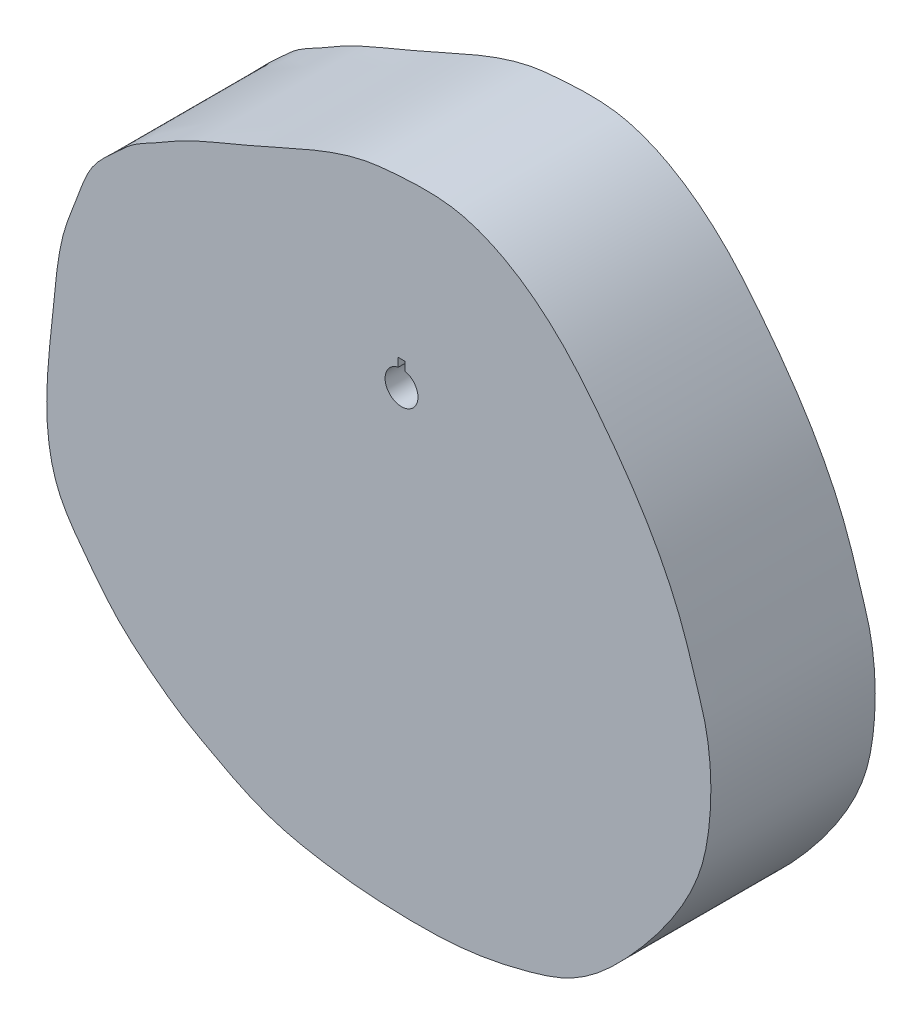
from build123d import *

# Parameters (mm, degrees)
EXTRUDE_6_DEPTH = 10


with BuildPart() as part:
    # Model → 凸台-拉伸6 (new body)
    # profile 1 of 5: a face of its own
    with BuildSketch(Plane.XY):
        with BuildLine():
            add(Edge.make_bspline(
                [(50.327348879, 72.110385395), (50.551196695, 72.209853079), (50.774771336, 72.310002208), (50.99828595, 72.410227179)],
                knots=[0.994126967, 0.994126967, 0.994126967, 0.994126967, 1, 1, 1, 1], degree=3))
            add(Edge.make_bspline(
                [(50.99828595, 72.410227179), (52.00855204, 72.863235095), (53.769573771, 73.656549063), (56.197949252, 74.4105602), (58.293529438, 74.604423777), (60.066206981, 74.693082407), (62.060842215, 74.541351708), (64.126269828, 73.834318473), (66.349208665, 72.490436035), (68.475957607, 70.616090239), (70.759213858, 67.843640334), (73.360295732, 64.257523025), (75.459483797, 60.178954808), (76.357096747, 57.126402616), (77.002925276, 55.061063067), (77.356950559, 53.017652635), (77.334939647, 50.285351358), (76.822227847, 47.030157279), (75.091971455, 43.71732089), (72.654728342, 40.694302093), (70.424080177, 38.502806605), (68.316461529, 37.217387766), (66.238861486, 36.572685886), (63.962576858, 36.03676818), (61.367476886, 35.701877622), (58.726180761, 35.685427345), (56.067919129, 35.81112316), (53.544167975, 36.137482718), (51.11894155, 36.594554509), (48.813349179, 37.505045086), (46.975869576, 38.505075731), (45.233846145, 39.4393401), (43.277399852, 40.841836991), (41.139900825, 42.596061425), (39.299034251, 45.033791125), (37.29945877, 47.651580718), (36.766606498, 51.39009884), (37.075288646, 54.929946918), (37.429133575, 58.326632929), (37.740859687, 61.17608892), (38.800732341, 63.667905164), (39.499386787, 65.796117339), (40.975310964, 67.073149421), (42.151744933, 68.217615029), (43.509812794, 68.879131649), (45.224172764, 69.943141406), (47.382369971, 70.856185044), (49.215606742, 71.619112396), (50.143195558, 72.028556121), (50.327348879, 72.110385395)],
                knots=[0, 0, 0, 0, 0.026545586, 0.046328554, 0.060553475, 0.076867854, 0.088874367, 0.108295375, 0.12851837, 0.150854463, 0.17589792, 0.214482615, 0.256992751, 0.28498903, 0.290659406, 0.308875672, 0.33440091, 0.355920428, 0.387259923, 0.422470783, 0.449004595, 0.461678734, 0.481273675, 0.500786423, 0.517774705, 0.543868946, 0.564008175, 0.581535671, 0.604880577, 0.622945933, 0.640688461, 0.655045158, 0.670269379, 0.698381104, 0.720780204, 0.74353058, 0.776229956, 0.807771363, 0.829063148, 0.858259645, 0.875614659, 0.894090137, 0.910613695, 0.921398486, 0.933328696, 0.946471969, 0.969814483, 0.989295387, 0.994126967, 0.994126967, 0.994126967, 0.994126967], degree=3))
        make_face()
        with BuildLine():
            add(Edge.make_bspline(
                [(56.251302083, 62.345052083), (56.23073444, 62.335232097), (56.189042839, 62.315326512), (56.123393886, 62.290150746), (56.05419121, 62.26964269), (55.981823108, 62.252026497), (55.905982385, 62.238733264), (55.826854707, 62.229439715), (55.74446656, 62.22290953), (55.688381448, 62.222454659), (55.659722222, 62.222222222)],
                knots=[0, 0, 0, 0, 0.896967235, 1.818195668, 2.764091818, 3.736549999, 4.748721906, 5.792788735, 6.872125551, 8, 8, 8, 8], degree=3))
            add(Edge.make_bspline(
                [(55.659722222, 62.222222222), (55.638442195, 62.222367719), (55.59698153, 62.222651195), (55.536469715, 62.227878751), (55.478977925, 62.234773559), (55.424709985, 62.245908078), (55.373305092, 62.259176755), (55.324853268, 62.275561445), (55.279842249, 62.295616296), (55.237667005, 62.318272192), (55.198923242, 62.343959742), (55.162368041, 62.371469813), (55.128631634, 62.401576043), (55.096794127, 62.433441538), (55.068149136, 62.468148385), (55.041549829, 62.504539679), (55.017617743, 62.543292122), (54.989808486, 62.597197653), (54.960903133, 62.665712348), (54.935381149, 62.748379195), (54.919991615, 62.83030279), (54.91776574, 62.884632077), (54.916666667, 62.911458333)],
                knots=[0, 0, 0, 0, 1.118512267, 2.179238879, 3.191701636, 4.16145139, 5.089578407, 5.982104873, 6.847203939, 7.677764153, 8.49642878, 9.289127057, 10.081350653, 10.872111906, 11.655224959, 12.444960961, 13.240865015, 14.047279251, 15.632548039, 17.143788409, 18.589683966, 20, 20, 20, 20], degree=3))
            add(Edge.make_bspline(
                [(54.916666667, 62.911458333), (54.917218853, 62.938252753), (54.91832968, 62.992154816), (54.928441185, 63.072938433), (54.943898269, 63.153941159), (54.966289236, 63.235000662), (54.995060503, 63.316129475), (55.029903523, 63.397434535), (55.070952827, 63.478870065), (55.117803091, 63.559905085), (55.170587058, 63.63868082), (55.227444147, 63.714636543), (55.289116095, 63.786226751), (55.355354718, 63.853642573), (55.425672913, 63.917138353), (55.500666881, 63.976385521), (55.580147565, 64.031298989), (55.66293854, 64.082316864), (55.747937289, 64.127948771), (55.833310384, 64.168117655), (55.918722365, 64.201388326), (56.003304551, 64.229622102), (56.087975954, 64.250722619), (56.1721163, 64.26662008), (56.256297182, 64.275980298), (56.312333067, 64.277179663), (56.340277778, 64.277777778)],
                knots=[0, 0, 0, 0, 0.891727813, 1.793879796, 2.706413147, 3.635387819, 4.590565755, 5.57025294, 6.578371844, 7.625104803, 8.684483968, 9.733563766, 10.782112664, 11.827781172, 12.878220176, 13.934386086, 15.007311527, 16.092813136, 17.17034535, 18.21761013, 19.231923723, 20.220475117, 21.184261265, 22.134654363, 23.069764973, 24, 24, 24, 24], degree=3))
            add(Edge.make_bspline(
                [(56.340277778, 64.277777778), (56.372619915, 64.276725409), (56.436884043, 64.274634342), (56.531664697, 64.256817783), (56.624086365, 64.229261262), (56.697710471, 64.196077917), (56.754510452, 64.165128911), (56.794619876, 64.139013049), (56.832841132, 64.111195541), (56.868153064, 64.080778646), (56.901579562, 64.048642256), (56.931821198, 64.013646266), (56.960203441, 63.976855272), (56.993651565, 63.925310347), (57.029409203, 63.859310286), (57.060477945, 63.777799639), (57.079754863, 63.695630181), (57.082147092, 63.640579431), (57.083333333, 63.61328125)],
                knots=[0, 0, 0, 0, 1.404869401, 2.791488554, 4.178207542, 5.588808834, 6.292523413, 6.988580247, 7.667841365, 8.345907703, 9.013035821, 9.681585379, 10.354557584, 11.031368594, 12.350988927, 13.608983188, 14.814359309, 16, 16, 16, 16], degree=3))
            add(Edge.make_bspline(
                [(57.083333333, 63.61328125), (57.082617984, 63.58271288), (57.081181669, 63.521336177), (57.068284074, 63.429323355), (57.048463407, 63.337283096), (57.020383853, 63.24512818), (56.984250518, 63.152987053), (56.939669822, 63.060904556), (56.88741343, 62.968741838), (56.827986546, 62.877774955), (56.763639322, 62.790078389), (56.696855748, 62.707263432), (56.627670862, 62.631082785), (56.556399752, 62.561235256), (56.483704681, 62.496977553), (56.408175731, 62.440266614), (56.331378621, 62.388803353), (56.277865121, 62.359565281), (56.251302083, 62.345052083)],
                knots=[0, 0, 0, 0, 0.926444821, 1.860162235, 2.811792735, 3.779037682, 4.77776186, 5.809794321, 6.878432778, 7.988097194, 9.102408143, 10.175287959, 11.212509676, 12.220669197, 13.199935719, 14.151869495, 15.082624735, 16, 16, 16, 16], degree=3))
        make_face(mode=Mode.SUBTRACT)
        with BuildLine():
            Line((58, 60.5), (57.031914894, 60.5))
            Line((57.031914894, 60.5), (58.060447136, 62.601783278))
            ThreePointArc((58.060447136, 62.601783278), (57.508037392, 63.626531356), (58.3, 64.479795897))
            Line((58.3, 64.479795897), (58.3, 65))
            Line((58.3, 65), (58.5, 65))
            Line((58.5, 65), (58.7, 65))
            Line((58.7, 65), (58.712882856, 64.47707773))
            ThreePointArc((58.712882856, 64.47707773), (59.278743493, 64.127342468), (59.5, 63.5))
            ThreePointArc((59.5, 63.5), (59.348396388, 62.970638528), (58.939552864, 62.601783278))
            Line((58.939552864, 62.601783278), (59.968085106, 60.5))
            Line((59.968085106, 60.5), (59.122532015, 60.5))
            Line((59.122532015, 60.5), (58, 60.5))
        make_face(mode=Mode.SUBTRACT)
        with BuildLine():
            add(Edge.make_bspline(
                [(64.256944444, 66.977213542), (64.256459199, 67.001833409), (64.255543183, 67.048309263), (64.247870138, 67.1140279), (64.236030423, 67.171929336), (64.217741005, 67.222641095), (64.193691643, 67.2678463), (64.163667833, 67.309545203), (64.126163165, 67.347591393), (64.097861664, 67.370291527), (64.083333333, 67.381944444)],
                knots=[0, 0, 0, 0, 1.283547308, 2.423000768, 3.446000759, 4.358955944, 5.223879375, 6.108680517, 7.029107533, 8, 8, 8, 8], degree=3))
            Line((64.083333333, 67.381944444), (64.116427951, 67.486111111))
            add(Edge.make_bspline(
                [(64.116427951, 67.486111111), (64.141829877, 67.481039942), (64.191382375, 67.47114742), (64.262487501, 67.450757318), (64.32878241, 67.427754545), (64.389956049, 67.400847254), (64.446732276, 67.371334573), (64.49810854, 67.337392997), (64.545440491, 67.30131211), (64.586723729, 67.260555846), (64.623847893, 67.217182075), (64.656141352, 67.170406051), (64.68271191, 67.119772923), (64.70524232, 67.066179527), (64.721652349, 67.008703533), (64.734485572, 66.948401057), (64.741263855, 66.88459297), (64.74244949, 66.841050933), (64.743055556, 66.818793403)],
                knots=[0, 0, 0, 0, 1.230694538, 2.400762403, 3.512648367, 4.563451363, 5.574697968, 6.549790304, 7.486862249, 8.398638349, 9.301129484, 10.197583272, 11.09354242, 12.014590101, 12.955635291, 13.93000754, 14.941874979, 16, 16, 16, 16], degree=3))
            add(Edge.make_bspline(
                [(64.743055556, 66.818793403), (64.742664828, 66.794542316), (64.74188779, 66.746314266), (64.734800948, 66.674279696), (64.725074283, 66.602756284), (64.709340798, 66.532088218), (64.690563173, 66.461889996), (64.667091681, 66.392352431), (64.639385488, 66.323335075), (64.607565334, 66.255664373), (64.572790993, 66.190124358), (64.533884249, 66.128824615), (64.493104884, 66.070996005), (64.44805477, 66.018385346), (64.401210985, 65.969328695), (64.350719679, 65.925148484), (64.297674598, 65.884946768), (64.241818274, 65.849327437), (64.184458231, 65.817951587), (64.126184773, 65.79085012), (64.067613871, 65.767306849), (64.008326321, 65.748294816), (63.948680385, 65.733591447), (63.888466745, 65.723381562), (63.827957939, 65.71651387), (63.787308693, 65.715689112), (63.76703559, 65.715277778)],
                knots=[0, 0, 0, 0, 1.066069101, 2.120087793, 3.180596127, 4.23808889, 5.301009471, 6.374791712, 7.463110282, 8.56949502, 9.661757627, 10.723011066, 11.760216631, 12.770270922, 13.765694197, 14.740446773, 15.716981792, 16.689786159, 17.650653824, 18.589855131, 19.514261735, 20.424640739, 21.325347771, 22.213042415, 23.10878606, 24, 24, 24, 24], degree=3))
            add(Edge.make_bspline(
                [(63.76703559, 65.715277778), (63.738400723, 65.716198668), (63.682576643, 65.717993955), (63.6014557, 65.732493797), (63.52534774, 65.755851339), (63.465773493, 65.783117819), (63.421563354, 65.811444064), (63.390757207, 65.837686756), (63.36169469, 65.868317701), (63.335246776, 65.903809822), (63.31073455, 65.943842375), (63.28809329, 65.988285232), (63.267270687, 66.037374093), (63.255887809, 66.072170686), (63.25, 66.090169271)],
                knots=[0, 0, 0, 0, 1.480804736, 2.886849817, 4.248287307, 5.591955812, 6.261554609, 6.958824823, 7.680286399, 8.441949633, 9.244364727, 10.106429626, 11.020548113, 12, 12, 12, 12], degree=3))
            add(Edge.make_bspline(
                [(63.25, 66.090169271), (63.223497886, 66.060448208), (63.172377965, 66.003119256), (63.091016032, 65.926805566), (63.009816091, 65.861759614), (62.928002238, 65.808735424), (62.846255446, 65.766673075), (62.763677869, 65.737092619), (62.680585621, 65.71894436), (62.624905378, 65.716492178), (62.597330729, 65.715277778)],
                knots=[0, 0, 0, 0, 1.230561598, 2.373629984, 3.444116081, 4.442817059, 5.382946957, 6.279526923, 7.147966365, 8, 8, 8, 8], degree=3))
            add(Edge.make_bspline(
                [(62.597330729, 65.715277778), (62.577947833, 65.715557698), (62.540286183, 65.716101592), (62.485687397, 65.724251209), (62.434310611, 65.735826703), (62.386539922, 65.752793456), (62.341825246, 65.773920009), (62.301227123, 65.800723266), (62.26382781, 65.831963337), (62.230240729, 65.867920269), (62.20011104, 65.908168412), (62.174832859, 65.953313927), (62.152333158, 66.001711928), (62.135333075, 66.054715054), (62.12087404, 66.111147011), (62.11157471, 66.172028449), (62.105425278, 66.236708266), (62.104593605, 66.281126106), (62.104166667, 66.303927951)],
                knots=[0, 0, 0, 0, 1.064309407, 2.067990596, 3.027587476, 3.954983563, 4.848577666, 5.739070541, 6.621034822, 7.521128678, 8.437593668, 9.377056361, 10.360099328, 11.365943837, 12.431505728, 13.559057255, 14.746944955, 16, 16, 16, 16], degree=3))
            add(Edge.make_bspline(
                [(62.104166667, 66.303927951), (62.104964504, 66.344134103), (62.106534262, 66.423240374), (62.123131865, 66.539398303), (62.148285475, 66.651213665), (62.184332012, 66.758619023), (62.230644542, 66.861676359), (62.287346149, 66.960043353), (62.353962676, 67.05415319), (62.430524842, 67.142021064), (62.513690408, 67.222799755), (62.601945782, 67.293964454), (62.694625801, 67.354066782), (62.791598443, 67.403094082), (62.8925302, 67.441355114), (62.997472867, 67.468502996), (63.106411361, 67.485256874), (63.180495646, 67.487264945), (63.217990451, 67.48828125)],
                knots=[0, 0, 0, 0, 1.067525049, 2.100373227, 3.110897175, 4.109135814, 5.104838923, 6.107830227, 7.12102351, 8.163327655, 9.199690166, 10.197685951, 11.170568541, 12.128915407, 13.079291884, 14.03256669, 15.004262114, 16, 16, 16, 16], degree=3))
            add(Edge.make_bspline(
                [(63.217990451, 67.48828125), (63.226672085, 67.488135235), (63.248565315, 67.487767016), (63.270437972, 67.486734306), (63.283637153, 67.486111111)],
                knots=[0, 0, 0, 0, 0.793088448, 2, 2, 2, 2], degree=3))
            Line((63.283637153, 67.486111111), (63.25, 67.381944444))
            add(Edge.make_bspline(
                [(63.25, 67.381944444), (63.224399398, 67.375937857), (63.173210363, 67.363927536), (63.100770252, 67.329995458), (63.032357242, 67.285353109), (62.969227142, 67.227850774), (62.910061021, 67.159290596), (62.856254253, 67.078375189), (62.80613121, 66.98614703), (62.762400424, 66.884385365), (62.722869545, 66.779589792), (62.687397832, 66.677471215), (62.658086249, 66.579816123), (62.633548397, 66.487416206), (62.614248358, 66.399660659), (62.600690481, 66.316721387), (62.591997384, 66.238466584), (62.590837599, 66.187845825), (62.590277778, 66.163411458)],
                knots=[0, 0, 0, 0, 0.855103626, 1.709800815, 2.591019403, 3.509367612, 4.483119723, 5.535995587, 6.670228212, 7.900168001, 9.142713519, 10.320838189, 11.422939906, 12.465235168, 13.436432596, 14.350267265, 15.203682911, 16, 16, 16, 16], degree=3))
            add(Edge.make_bspline(
                [(62.590277778, 66.163411458), (62.591028638, 66.144195333), (62.592464273, 66.107454316), (62.602793971, 66.054626402), (62.620697294, 66.007353623), (62.644940973, 65.965629068), (62.675855839, 65.931094168), (62.714010068, 65.906793381), (62.757506043, 65.891342809), (62.788530106, 65.88972552), (62.804578993, 65.888888889)],
                knots=[0, 0, 0, 0, 1.179200601, 2.254618313, 3.287488402, 4.267908147, 5.202779581, 6.1018399, 7.018073269, 8, 8, 8, 8], degree=3))
            add(Edge.make_bspline(
                [(62.804578993, 65.888888889), (62.820402862, 65.889939287), (62.853175193, 65.892114733), (62.902970352, 65.907242423), (62.953891478, 65.93226208), (63.006603272, 65.966215088), (63.060796103, 66.009816637), (63.116175696, 66.063424284), (63.174560565, 66.125590692), (63.211635514, 66.17216555), (63.231011285, 66.196506076)],
                knots=[0, 0, 0, 0, 0.700870155, 1.451550693, 2.286656986, 3.209151831, 4.224081867, 5.363340262, 6.622053006, 8, 8, 8, 8], degree=3))
            add(Edge.make_bspline(
                [(63.231011285, 66.196506076), (63.226355043, 66.241858215), (63.21742798, 66.328808455), (63.215973581, 66.416199043), (63.215277778, 66.458007812)],
                knots=[0, 0, 0, 0, 1.043174559, 2, 2, 2, 2], degree=3))
            add(Edge.make_bspline(
                [(63.215277778, 66.458007812), (63.215710196, 66.486593267), (63.216556838, 66.54256135), (63.222715905, 66.624574306), (63.232111361, 66.703090144), (63.24670897, 66.777908032), (63.263190812, 66.849693488), (63.286209885, 66.917099559), (63.311312234, 66.981577219), (63.340994657, 67.041670001), (63.373067523, 67.096441444), (63.406533154, 67.144630869), (63.44171051, 67.18505512), (63.477047978, 67.219490196), (63.51503903, 67.244968437), (63.553480068, 67.264234495), (63.593708929, 67.275422065), (63.621029685, 67.276993804), (63.634657118, 67.277777778)],
                knots=[0, 0, 0, 0, 1.37441586, 2.690998714, 3.952974798, 5.174142744, 6.355269713, 7.490994922, 8.595529988, 9.680586356, 10.709663641, 11.645772132, 12.496563913, 13.284024574, 14.010027431, 14.686756566, 15.344961831, 16, 16, 16, 16], degree=3))
            add(Edge.make_bspline(
                [(63.634657118, 67.277777778), (63.648094397, 67.277179576), (63.673516771, 67.276047822), (63.709188316, 67.266912708), (63.73935344, 67.250887698), (63.764084043, 67.228297536), (63.783386737, 67.199523867), (63.796073384, 67.164132107), (63.804289544, 67.123171688), (63.805117165, 67.093723615), (63.805555556, 67.078125)],
                knots=[0, 0, 0, 0, 1.072196203, 2.028518891, 2.913716552, 3.772484424, 4.677718043, 5.651331581, 6.755912644, 8, 8, 8, 8], degree=3))
            add(Edge.make_bspline(
                [(63.805555556, 67.078125), (63.80532586, 67.063452323), (63.804853283, 67.033264634), (63.798050067, 66.987535173), (63.789889588, 66.93986961), (63.77646529, 66.891035692), (63.759490066, 66.840633394), (63.739503569, 66.788368573), (63.715336838, 66.734809712), (63.688391989, 66.679139639), (63.656754959, 66.622572499), (63.621777544, 66.564174423), (63.583517352, 66.504097347), (63.54077505, 66.442680618), (63.494947041, 66.379463177), (63.445354903, 66.314720964), (63.392210613, 66.248480481), (63.354814153, 66.204376164), (63.335720486, 66.181857639)],
                knots=[0, 0, 0, 0, 0.682904125, 1.405012718, 2.150292302, 2.935052238, 3.760973687, 4.627780832, 5.540538739, 6.497598878, 7.508229277, 8.558672091, 9.668809985, 10.825633971, 12.044049998, 13.306190869, 14.624610648, 16, 16, 16, 16], degree=3))
            add(Edge.make_bspline(
                [(63.335720486, 66.181857639), (63.340525467, 66.158723242), (63.349618489, 66.114943342), (63.372175579, 66.05484378), (63.400229225, 66.003738151), (63.434199673, 65.961576201), (63.474079402, 65.928459088), (63.520360221, 65.905579629), (63.572092823, 65.890832264), (63.608690728, 65.889551022), (63.627604167, 65.888888889)],
                knots=[0, 0, 0, 0, 1.243511045, 2.353240068, 3.36857749, 4.303213716, 5.19024586, 6.076663574, 7.006038593, 8, 8, 8, 8], degree=3))
            add(Edge.make_bspline(
                [(63.627604167, 65.888888889), (63.649242045, 65.890066392), (63.692492789, 65.892420038), (63.755726013, 65.91068062), (63.816201618, 65.939897779), (63.873869893, 65.981021411), (63.92867183, 66.033710668), (63.980749862, 66.097863948), (64.03026051, 66.173339148), (64.075324283, 66.258940156), (64.11727469, 66.349222437), (64.154464576, 66.440830038), (64.185771671, 66.5318007), (64.212142764, 66.622041008), (64.232342547, 66.71173166), (64.246199978, 66.800742767), (64.255532435, 66.889124002), (64.256474462, 66.94789324), (64.256944444, 66.977213542)],
                knots=[0, 0, 0, 0, 0.762919419, 1.524956928, 2.304443095, 3.12449112, 4.014051067, 4.980211623, 6.035483199, 7.195100811, 8.391817129, 9.548831148, 10.683437524, 11.786573522, 12.866070949, 13.926101275, 14.965320307, 16, 16, 16, 16], degree=3))
        make_face(mode=Mode.SUBTRACT)
    # profile 2 of 5: a face of its own
    with BuildSketch(Plane.XY):
        with BuildLine():
            Line((58.060447136, 62.601783278), (57.031914894, 60.5))
            Line((57.031914894, 60.5), (58, 60.5))
            Line((58, 60.5), (59.122532015, 60.5))
            Line((59.122532015, 60.5), (59.968085106, 60.5))
            Line((59.968085106, 60.5), (58.939552864, 62.601783278))
            ThreePointArc((58.939552864, 62.601783278), (58.5, 62.5), (58.060447136, 62.601783278))
        make_face()
    # profile 3 of 5: a face of its own
    with BuildSketch(Plane.XY):
        with BuildLine():
            Line((64.116427951, 67.486111111), (64.083333333, 67.381944444))
            add(Edge.make_bspline(
                [(64.256944444, 66.977213542), (64.256459199, 67.001833409), (64.255543183, 67.048309263), (64.247870138, 67.1140279), (64.236030423, 67.171929336), (64.217741005, 67.222641095), (64.193691643, 67.2678463), (64.163667833, 67.309545203), (64.126163165, 67.347591393), (64.097861664, 67.370291527), (64.083333333, 67.381944444)],
                knots=[0, 0, 0, 0, 1.283547308, 2.423000768, 3.446000759, 4.358955944, 5.223879375, 6.108680517, 7.029107533, 8, 8, 8, 8], degree=3))
            add(Edge.make_bspline(
                [(63.627604167, 65.888888889), (63.649242045, 65.890066392), (63.692492789, 65.892420038), (63.755726013, 65.91068062), (63.816201618, 65.939897779), (63.873869893, 65.981021411), (63.92867183, 66.033710668), (63.980749862, 66.097863948), (64.03026051, 66.173339148), (64.075324283, 66.258940156), (64.11727469, 66.349222437), (64.154464576, 66.440830038), (64.185771671, 66.5318007), (64.212142764, 66.622041008), (64.232342547, 66.71173166), (64.246199978, 66.800742767), (64.255532435, 66.889124002), (64.256474462, 66.94789324), (64.256944444, 66.977213542)],
                knots=[0, 0, 0, 0, 0.762919419, 1.524956928, 2.304443095, 3.12449112, 4.014051067, 4.980211623, 6.035483199, 7.195100811, 8.391817129, 9.548831148, 10.683437524, 11.786573522, 12.866070949, 13.926101275, 14.965320307, 16, 16, 16, 16], degree=3))
            add(Edge.make_bspline(
                [(63.335720486, 66.181857639), (63.340525467, 66.158723242), (63.349618489, 66.114943342), (63.372175579, 66.05484378), (63.400229225, 66.003738151), (63.434199673, 65.961576201), (63.474079402, 65.928459088), (63.520360221, 65.905579629), (63.572092823, 65.890832264), (63.608690728, 65.889551022), (63.627604167, 65.888888889)],
                knots=[0, 0, 0, 0, 1.243511045, 2.353240068, 3.36857749, 4.303213716, 5.19024586, 6.076663574, 7.006038593, 8, 8, 8, 8], degree=3))
            add(Edge.make_bspline(
                [(63.805555556, 67.078125), (63.80532586, 67.063452323), (63.804853283, 67.033264634), (63.798050067, 66.987535173), (63.789889588, 66.93986961), (63.77646529, 66.891035692), (63.759490066, 66.840633394), (63.739503569, 66.788368573), (63.715336838, 66.734809712), (63.688391989, 66.679139639), (63.656754959, 66.622572499), (63.621777544, 66.564174423), (63.583517352, 66.504097347), (63.54077505, 66.442680618), (63.494947041, 66.379463177), (63.445354903, 66.314720964), (63.392210613, 66.248480481), (63.354814153, 66.204376164), (63.335720486, 66.181857639)],
                knots=[0, 0, 0, 0, 0.682904125, 1.405012718, 2.150292302, 2.935052238, 3.760973687, 4.627780832, 5.540538739, 6.497598878, 7.508229277, 8.558672091, 9.668809985, 10.825633971, 12.044049998, 13.306190869, 14.624610648, 16, 16, 16, 16], degree=3))
            add(Edge.make_bspline(
                [(63.634657118, 67.277777778), (63.648094397, 67.277179576), (63.673516771, 67.276047822), (63.709188316, 67.266912708), (63.73935344, 67.250887698), (63.764084043, 67.228297536), (63.783386737, 67.199523867), (63.796073384, 67.164132107), (63.804289544, 67.123171688), (63.805117165, 67.093723615), (63.805555556, 67.078125)],
                knots=[0, 0, 0, 0, 1.072196203, 2.028518891, 2.913716552, 3.772484424, 4.677718043, 5.651331581, 6.755912644, 8, 8, 8, 8], degree=3))
            add(Edge.make_bspline(
                [(63.215277778, 66.458007812), (63.215710196, 66.486593267), (63.216556838, 66.54256135), (63.222715905, 66.624574306), (63.232111361, 66.703090144), (63.24670897, 66.777908032), (63.263190812, 66.849693488), (63.286209885, 66.917099559), (63.311312234, 66.981577219), (63.340994657, 67.041670001), (63.373067523, 67.096441444), (63.406533154, 67.144630869), (63.44171051, 67.18505512), (63.477047978, 67.219490196), (63.51503903, 67.244968437), (63.553480068, 67.264234495), (63.593708929, 67.275422065), (63.621029685, 67.276993804), (63.634657118, 67.277777778)],
                knots=[0, 0, 0, 0, 1.37441586, 2.690998714, 3.952974798, 5.174142744, 6.355269713, 7.490994922, 8.595529988, 9.680586356, 10.709663641, 11.645772132, 12.496563913, 13.284024574, 14.010027431, 14.686756566, 15.344961831, 16, 16, 16, 16], degree=3))
            add(Edge.make_bspline(
                [(63.231011285, 66.196506076), (63.226355043, 66.241858215), (63.21742798, 66.328808455), (63.215973581, 66.416199043), (63.215277778, 66.458007812)],
                knots=[0, 0, 0, 0, 1.043174559, 2, 2, 2, 2], degree=3))
            add(Edge.make_bspline(
                [(62.804578993, 65.888888889), (62.820402862, 65.889939287), (62.853175193, 65.892114733), (62.902970352, 65.907242423), (62.953891478, 65.93226208), (63.006603272, 65.966215088), (63.060796103, 66.009816637), (63.116175696, 66.063424284), (63.174560565, 66.125590692), (63.211635514, 66.17216555), (63.231011285, 66.196506076)],
                knots=[0, 0, 0, 0, 0.700870155, 1.451550693, 2.286656986, 3.209151831, 4.224081867, 5.363340262, 6.622053006, 8, 8, 8, 8], degree=3))
            add(Edge.make_bspline(
                [(62.590277778, 66.163411458), (62.591028638, 66.144195333), (62.592464273, 66.107454316), (62.602793971, 66.054626402), (62.620697294, 66.007353623), (62.644940973, 65.965629068), (62.675855839, 65.931094168), (62.714010068, 65.906793381), (62.757506043, 65.891342809), (62.788530106, 65.88972552), (62.804578993, 65.888888889)],
                knots=[0, 0, 0, 0, 1.179200601, 2.254618313, 3.287488402, 4.267908147, 5.202779581, 6.1018399, 7.018073269, 8, 8, 8, 8], degree=3))
            add(Edge.make_bspline(
                [(63.25, 67.381944444), (63.224399398, 67.375937857), (63.173210363, 67.363927536), (63.100770252, 67.329995458), (63.032357242, 67.285353109), (62.969227142, 67.227850774), (62.910061021, 67.159290596), (62.856254253, 67.078375189), (62.80613121, 66.98614703), (62.762400424, 66.884385365), (62.722869545, 66.779589792), (62.687397832, 66.677471215), (62.658086249, 66.579816123), (62.633548397, 66.487416206), (62.614248358, 66.399660659), (62.600690481, 66.316721387), (62.591997384, 66.238466584), (62.590837599, 66.187845825), (62.590277778, 66.163411458)],
                knots=[0, 0, 0, 0, 0.855103626, 1.709800815, 2.591019403, 3.509367612, 4.483119723, 5.535995587, 6.670228212, 7.900168001, 9.142713519, 10.320838189, 11.422939906, 12.465235168, 13.436432596, 14.350267265, 15.203682911, 16, 16, 16, 16], degree=3))
            Line((63.25, 67.381944444), (63.283637153, 67.486111111))
            add(Edge.make_bspline(
                [(63.217990451, 67.48828125), (63.226672085, 67.488135235), (63.248565315, 67.487767016), (63.270437972, 67.486734306), (63.283637153, 67.486111111)],
                knots=[0, 0, 0, 0, 0.793088448, 2, 2, 2, 2], degree=3))
            add(Edge.make_bspline(
                [(62.104166667, 66.303927951), (62.104964504, 66.344134103), (62.106534262, 66.423240374), (62.123131865, 66.539398303), (62.148285475, 66.651213665), (62.184332012, 66.758619023), (62.230644542, 66.861676359), (62.287346149, 66.960043353), (62.353962676, 67.05415319), (62.430524842, 67.142021064), (62.513690408, 67.222799755), (62.601945782, 67.293964454), (62.694625801, 67.354066782), (62.791598443, 67.403094082), (62.8925302, 67.441355114), (62.997472867, 67.468502996), (63.106411361, 67.485256874), (63.180495646, 67.487264945), (63.217990451, 67.48828125)],
                knots=[0, 0, 0, 0, 1.067525049, 2.100373227, 3.110897175, 4.109135814, 5.104838923, 6.107830227, 7.12102351, 8.163327655, 9.199690166, 10.197685951, 11.170568541, 12.128915407, 13.079291884, 14.03256669, 15.004262114, 16, 16, 16, 16], degree=3))
            add(Edge.make_bspline(
                [(62.597330729, 65.715277778), (62.577947833, 65.715557698), (62.540286183, 65.716101592), (62.485687397, 65.724251209), (62.434310611, 65.735826703), (62.386539922, 65.752793456), (62.341825246, 65.773920009), (62.301227123, 65.800723266), (62.26382781, 65.831963337), (62.230240729, 65.867920269), (62.20011104, 65.908168412), (62.174832859, 65.953313927), (62.152333158, 66.001711928), (62.135333075, 66.054715054), (62.12087404, 66.111147011), (62.11157471, 66.172028449), (62.105425278, 66.236708266), (62.104593605, 66.281126106), (62.104166667, 66.303927951)],
                knots=[0, 0, 0, 0, 1.064309407, 2.067990596, 3.027587476, 3.954983563, 4.848577666, 5.739070541, 6.621034822, 7.521128678, 8.437593668, 9.377056361, 10.360099328, 11.365943837, 12.431505728, 13.559057255, 14.746944955, 16, 16, 16, 16], degree=3))
            add(Edge.make_bspline(
                [(63.25, 66.090169271), (63.223497886, 66.060448208), (63.172377965, 66.003119256), (63.091016032, 65.926805566), (63.009816091, 65.861759614), (62.928002238, 65.808735424), (62.846255446, 65.766673075), (62.763677869, 65.737092619), (62.680585621, 65.71894436), (62.624905378, 65.716492178), (62.597330729, 65.715277778)],
                knots=[0, 0, 0, 0, 1.230561598, 2.373629984, 3.444116081, 4.442817059, 5.382946957, 6.279526923, 7.147966365, 8, 8, 8, 8], degree=3))
            add(Edge.make_bspline(
                [(63.76703559, 65.715277778), (63.738400723, 65.716198668), (63.682576643, 65.717993955), (63.6014557, 65.732493797), (63.52534774, 65.755851339), (63.465773493, 65.783117819), (63.421563354, 65.811444064), (63.390757207, 65.837686756), (63.36169469, 65.868317701), (63.335246776, 65.903809822), (63.31073455, 65.943842375), (63.28809329, 65.988285232), (63.267270687, 66.037374093), (63.255887809, 66.072170686), (63.25, 66.090169271)],
                knots=[0, 0, 0, 0, 1.480804736, 2.886849817, 4.248287307, 5.591955812, 6.261554609, 6.958824823, 7.680286399, 8.441949633, 9.244364727, 10.106429626, 11.020548113, 12, 12, 12, 12], degree=3))
            add(Edge.make_bspline(
                [(64.743055556, 66.818793403), (64.742664828, 66.794542316), (64.74188779, 66.746314266), (64.734800948, 66.674279696), (64.725074283, 66.602756284), (64.709340798, 66.532088218), (64.690563173, 66.461889996), (64.667091681, 66.392352431), (64.639385488, 66.323335075), (64.607565334, 66.255664373), (64.572790993, 66.190124358), (64.533884249, 66.128824615), (64.493104884, 66.070996005), (64.44805477, 66.018385346), (64.401210985, 65.969328695), (64.350719679, 65.925148484), (64.297674598, 65.884946768), (64.241818274, 65.849327437), (64.184458231, 65.817951587), (64.126184773, 65.79085012), (64.067613871, 65.767306849), (64.008326321, 65.748294816), (63.948680385, 65.733591447), (63.888466745, 65.723381562), (63.827957939, 65.71651387), (63.787308693, 65.715689112), (63.76703559, 65.715277778)],
                knots=[0, 0, 0, 0, 1.066069101, 2.120087793, 3.180596127, 4.23808889, 5.301009471, 6.374791712, 7.463110282, 8.56949502, 9.661757627, 10.723011066, 11.760216631, 12.770270922, 13.765694197, 14.740446773, 15.716981792, 16.689786159, 17.650653824, 18.589855131, 19.514261735, 20.424640739, 21.325347771, 22.213042415, 23.10878606, 24, 24, 24, 24], degree=3))
            add(Edge.make_bspline(
                [(64.116427951, 67.486111111), (64.141829877, 67.481039942), (64.191382375, 67.47114742), (64.262487501, 67.450757318), (64.32878241, 67.427754545), (64.389956049, 67.400847254), (64.446732276, 67.371334573), (64.49810854, 67.337392997), (64.545440491, 67.30131211), (64.586723729, 67.260555846), (64.623847893, 67.217182075), (64.656141352, 67.170406051), (64.68271191, 67.119772923), (64.70524232, 67.066179527), (64.721652349, 67.008703533), (64.734485572, 66.948401057), (64.741263855, 66.88459297), (64.74244949, 66.841050933), (64.743055556, 66.818793403)],
                knots=[0, 0, 0, 0, 1.230694538, 2.400762403, 3.512648367, 4.563451363, 5.574697968, 6.549790304, 7.486862249, 8.398638349, 9.301129484, 10.197583272, 11.09354242, 12.014590101, 12.955635291, 13.93000754, 14.941874979, 16, 16, 16, 16], degree=3))
        make_face()
    # profile 4 of 5: a face of its own
    with BuildSketch(Plane.XY):
        with BuildLine():
            add(Edge.make_bspline(
                [(55.659722222, 62.222222222), (55.638442195, 62.222367719), (55.59698153, 62.222651195), (55.536469715, 62.227878751), (55.478977925, 62.234773559), (55.424709985, 62.245908078), (55.373305092, 62.259176755), (55.324853268, 62.275561445), (55.279842249, 62.295616296), (55.237667005, 62.318272192), (55.198923242, 62.343959742), (55.162368041, 62.371469813), (55.128631634, 62.401576043), (55.096794127, 62.433441538), (55.068149136, 62.468148385), (55.041549829, 62.504539679), (55.017617743, 62.543292122), (54.989808486, 62.597197653), (54.960903133, 62.665712348), (54.935381149, 62.748379195), (54.919991615, 62.83030279), (54.91776574, 62.884632077), (54.916666667, 62.911458333)],
                knots=[0, 0, 0, 0, 1.118512267, 2.179238879, 3.191701636, 4.16145139, 5.089578407, 5.982104873, 6.847203939, 7.677764153, 8.49642878, 9.289127057, 10.081350653, 10.872111906, 11.655224959, 12.444960961, 13.240865015, 14.047279251, 15.632548039, 17.143788409, 18.589683966, 20, 20, 20, 20], degree=3))
            add(Edge.make_bspline(
                [(56.251302083, 62.345052083), (56.23073444, 62.335232097), (56.189042839, 62.315326512), (56.123393886, 62.290150746), (56.05419121, 62.26964269), (55.981823108, 62.252026497), (55.905982385, 62.238733264), (55.826854707, 62.229439715), (55.74446656, 62.22290953), (55.688381448, 62.222454659), (55.659722222, 62.222222222)],
                knots=[0, 0, 0, 0, 0.896967235, 1.818195668, 2.764091818, 3.736549999, 4.748721906, 5.792788735, 6.872125551, 8, 8, 8, 8], degree=3))
            add(Edge.make_bspline(
                [(57.083333333, 63.61328125), (57.082617984, 63.58271288), (57.081181669, 63.521336177), (57.068284074, 63.429323355), (57.048463407, 63.337283096), (57.020383853, 63.24512818), (56.984250518, 63.152987053), (56.939669822, 63.060904556), (56.88741343, 62.968741838), (56.827986546, 62.877774955), (56.763639322, 62.790078389), (56.696855748, 62.707263432), (56.627670862, 62.631082785), (56.556399752, 62.561235256), (56.483704681, 62.496977553), (56.408175731, 62.440266614), (56.331378621, 62.388803353), (56.277865121, 62.359565281), (56.251302083, 62.345052083)],
                knots=[0, 0, 0, 0, 0.926444821, 1.860162235, 2.811792735, 3.779037682, 4.77776186, 5.809794321, 6.878432778, 7.988097194, 9.102408143, 10.175287959, 11.212509676, 12.220669197, 13.199935719, 14.151869495, 15.082624735, 16, 16, 16, 16], degree=3))
            add(Edge.make_bspline(
                [(56.340277778, 64.277777778), (56.372619915, 64.276725409), (56.436884043, 64.274634342), (56.531664697, 64.256817783), (56.624086365, 64.229261262), (56.697710471, 64.196077917), (56.754510452, 64.165128911), (56.794619876, 64.139013049), (56.832841132, 64.111195541), (56.868153064, 64.080778646), (56.901579562, 64.048642256), (56.931821198, 64.013646266), (56.960203441, 63.976855272), (56.993651565, 63.925310347), (57.029409203, 63.859310286), (57.060477945, 63.777799639), (57.079754863, 63.695630181), (57.082147092, 63.640579431), (57.083333333, 63.61328125)],
                knots=[0, 0, 0, 0, 1.404869401, 2.791488554, 4.178207542, 5.588808834, 6.292523413, 6.988580247, 7.667841365, 8.345907703, 9.013035821, 9.681585379, 10.354557584, 11.031368594, 12.350988927, 13.608983188, 14.814359309, 16, 16, 16, 16], degree=3))
            add(Edge.make_bspline(
                [(54.916666667, 62.911458333), (54.917218853, 62.938252753), (54.91832968, 62.992154816), (54.928441185, 63.072938433), (54.943898269, 63.153941159), (54.966289236, 63.235000662), (54.995060503, 63.316129475), (55.029903523, 63.397434535), (55.070952827, 63.478870065), (55.117803091, 63.559905085), (55.170587058, 63.63868082), (55.227444147, 63.714636543), (55.289116095, 63.786226751), (55.355354718, 63.853642573), (55.425672913, 63.917138353), (55.500666881, 63.976385521), (55.580147565, 64.031298989), (55.66293854, 64.082316864), (55.747937289, 64.127948771), (55.833310384, 64.168117655), (55.918722365, 64.201388326), (56.003304551, 64.229622102), (56.087975954, 64.250722619), (56.1721163, 64.26662008), (56.256297182, 64.275980298), (56.312333067, 64.277179663), (56.340277778, 64.277777778)],
                knots=[0, 0, 0, 0, 0.891727813, 1.793879796, 2.706413147, 3.635387819, 4.590565755, 5.57025294, 6.578371844, 7.625104803, 8.684483968, 9.733563766, 10.782112664, 11.827781172, 12.878220176, 13.934386086, 15.007311527, 16.092813136, 17.17034535, 18.21761013, 19.231923723, 20.220475117, 21.184261265, 22.134654363, 23.069764973, 24, 24, 24, 24], degree=3))
        make_face()
        with BuildLine():
            add(Edge.make_bspline(
                [(56.294270833, 64.166666667), (56.273700166, 64.166206002), (56.233991103, 64.165316747), (56.176812168, 64.157419086), (56.124336221, 64.14456973), (56.075710172, 64.125986995), (56.029687216, 64.100619847), (55.983088569, 64.069581323), (55.936341973, 64.030558734), (55.887337948, 63.985307352), (55.838716051, 63.930400012), (55.789494765, 63.865742797), (55.740390191, 63.790348583), (55.699551465, 63.720626307), (55.667000141, 63.658825787), (55.643026211, 63.60705914), (55.618486756, 63.551698077), (55.595270625, 63.491852836), (55.57179666, 63.428246418), (55.548787128, 63.360370535), (55.526306399, 63.28841935), (55.504610842, 63.213566893), (55.48388598, 63.138586354), (55.466175142, 63.065443579), (55.45073539, 62.995616928), (55.438731525, 62.928831291), (55.429005404, 62.865309545), (55.422136521, 62.805083094), (55.417366665, 62.748051375), (55.416895483, 62.711091086), (55.416666667, 62.693142361)],
                knots=[0, 0, 0, 0, 0.929487154, 1.794256975, 2.603191595, 3.367123199, 4.139600881, 4.973963596, 5.894248367, 6.889015047, 7.986638611, 9.204403412, 10.559352132, 12.051154573, 12.855582558, 13.715690781, 14.629399173, 15.592446035, 16.616616423, 17.694104889, 18.831737857, 20.023821523, 21.216873503, 22.347813622, 23.425321934, 24.448970187, 25.414567289, 26.32960876, 27.188821451, 28, 28, 28, 28], degree=3))
            add(Edge.make_bspline(
                [(56.583333333, 63.787760417), (56.583101044, 63.803827719), (56.582652466, 63.834855666), (56.578733393, 63.879666086), (56.572272547, 63.921158795), (56.563361499, 63.959258296), (56.551656926, 63.993903167), (56.537184903, 64.02499475), (56.520545835, 64.052992202), (56.494305046, 64.08433428), (56.458207473, 64.117654405), (56.407869321, 64.145778302), (56.352760763, 64.163733951), (56.314088116, 64.165673018), (56.294270833, 64.166666667)],
                knots=[0, 0, 0, 0, 1.073465636, 2.072994778, 3.002768943, 3.877381987, 4.684473903, 5.44137101, 6.165905093, 6.85289807, 8.167157467, 9.422608508, 10.679250043, 12, 12, 12, 12], degree=3))
            add(Edge.make_bspline(
                [(56.024305556, 62.439670139), (56.044733402, 62.458007436), (56.086124833, 62.49516294), (56.143234682, 62.557901323), (56.1981611, 62.626223826), (56.250067352, 62.700765408), (56.29881192, 62.781646267), (56.344786729, 62.868631958), (56.38802103, 62.961810437), (56.427810304, 63.059701262), (56.463479955, 63.159239627), (56.496106505, 63.256962941), (56.522248265, 63.352458948), (56.544908683, 63.444803957), (56.561453815, 63.534726256), (56.574628263, 63.621496101), (56.58149261, 63.705617301), (56.582726853, 63.760695973), (56.583333333, 63.787760417)],
                knots=[0, 0, 0, 0, 0.880585545, 1.784265164, 2.719048896, 3.692909943, 4.697129502, 5.74821306, 6.84928163, 7.992697359, 9.138439681, 10.242705472, 11.298353862, 12.31538557, 13.293510545, 14.23193176, 15.131210277, 16, 16, 16, 16], degree=3))
            add(Edge.make_bspline(
                [(55.722222222, 62.333333333), (55.73670154, 62.333699482), (55.765304521, 62.334422786), (55.80743727, 62.339176489), (55.847971993, 62.347411694), (55.886801038, 62.359120982), (55.923747715, 62.374471554), (55.959176015, 62.392679343), (55.992756344, 62.414556342), (56.013728832, 62.431250858), (56.024305556, 62.439670139)],
                knots=[0, 0, 0, 0, 1.061841361, 2.097600873, 3.10470616, 4.091486603, 5.066792466, 6.03485765, 7.00895084, 8, 8, 8, 8], degree=3))
            add(Edge.make_bspline(
                [(55.416666667, 62.693142361), (55.416915984, 62.678812691), (55.417400496, 62.650965134), (55.421162177, 62.610431203), (55.428267745, 62.572781613), (55.437197556, 62.537502464), (55.449333751, 62.505086418), (55.464031557, 62.475306446), (55.481749523, 62.448536653), (55.501508658, 62.42421188), (55.523896299, 62.402932918), (55.54768121, 62.384244077), (55.573074982, 62.368352476), (55.600161595, 62.355888462), (55.62849285, 62.345856597), (55.6582428, 62.338358424), (55.689681146, 62.33394915), (55.711212689, 62.333541681), (55.722222222, 62.333333333)],
                knots=[0, 0, 0, 0, 1.288196855, 2.503416699, 3.65392539, 4.729665906, 5.770886781, 6.75969405, 7.708427821, 8.650990174, 9.5708456, 10.478855311, 11.366707539, 12.25693816, 13.153700413, 14.06533567, 15.01076514, 16, 16, 16, 16], degree=3))
        make_face(mode=Mode.SUBTRACT)
    # profile 5 of 5: a face of its own
    with BuildSketch(Plane.XY):
        with BuildLine():
            add(Edge.make_bspline(
                [(56.583333333, 63.787760417), (56.583101044, 63.803827719), (56.582652466, 63.834855666), (56.578733393, 63.879666086), (56.572272547, 63.921158795), (56.563361499, 63.959258296), (56.551656926, 63.993903167), (56.537184903, 64.02499475), (56.520545835, 64.052992202), (56.494305046, 64.08433428), (56.458207473, 64.117654405), (56.407869321, 64.145778302), (56.352760763, 64.163733951), (56.314088116, 64.165673018), (56.294270833, 64.166666667)],
                knots=[0, 0, 0, 0, 1.073465636, 2.072994778, 3.002768943, 3.877381987, 4.684473903, 5.44137101, 6.165905093, 6.85289807, 8.167157467, 9.422608508, 10.679250043, 12, 12, 12, 12], degree=3))
            add(Edge.make_bspline(
                [(56.294270833, 64.166666667), (56.273700166, 64.166206002), (56.233991103, 64.165316747), (56.176812168, 64.157419086), (56.124336221, 64.14456973), (56.075710172, 64.125986995), (56.029687216, 64.100619847), (55.983088569, 64.069581323), (55.936341973, 64.030558734), (55.887337948, 63.985307352), (55.838716051, 63.930400012), (55.789494765, 63.865742797), (55.740390191, 63.790348583), (55.699551465, 63.720626307), (55.667000141, 63.658825787), (55.643026211, 63.60705914), (55.618486756, 63.551698077), (55.595270625, 63.491852836), (55.57179666, 63.428246418), (55.548787128, 63.360370535), (55.526306399, 63.28841935), (55.504610842, 63.213566893), (55.48388598, 63.138586354), (55.466175142, 63.065443579), (55.45073539, 62.995616928), (55.438731525, 62.928831291), (55.429005404, 62.865309545), (55.422136521, 62.805083094), (55.417366665, 62.748051375), (55.416895483, 62.711091086), (55.416666667, 62.693142361)],
                knots=[0, 0, 0, 0, 0.929487154, 1.794256975, 2.603191595, 3.367123199, 4.139600881, 4.973963596, 5.894248367, 6.889015047, 7.986638611, 9.204403412, 10.559352132, 12.051154573, 12.855582558, 13.715690781, 14.629399173, 15.592446035, 16.616616423, 17.694104889, 18.831737857, 20.023821523, 21.216873503, 22.347813622, 23.425321934, 24.448970187, 25.414567289, 26.32960876, 27.188821451, 28, 28, 28, 28], degree=3))
            add(Edge.make_bspline(
                [(55.416666667, 62.693142361), (55.416915984, 62.678812691), (55.417400496, 62.650965134), (55.421162177, 62.610431203), (55.428267745, 62.572781613), (55.437197556, 62.537502464), (55.449333751, 62.505086418), (55.464031557, 62.475306446), (55.481749523, 62.448536653), (55.501508658, 62.42421188), (55.523896299, 62.402932918), (55.54768121, 62.384244077), (55.573074982, 62.368352476), (55.600161595, 62.355888462), (55.62849285, 62.345856597), (55.6582428, 62.338358424), (55.689681146, 62.33394915), (55.711212689, 62.333541681), (55.722222222, 62.333333333)],
                knots=[0, 0, 0, 0, 1.288196855, 2.503416699, 3.65392539, 4.729665906, 5.770886781, 6.75969405, 7.708427821, 8.650990174, 9.5708456, 10.478855311, 11.366707539, 12.25693816, 13.153700413, 14.06533567, 15.01076514, 16, 16, 16, 16], degree=3))
            add(Edge.make_bspline(
                [(55.722222222, 62.333333333), (55.73670154, 62.333699482), (55.765304521, 62.334422786), (55.80743727, 62.339176489), (55.847971993, 62.347411694), (55.886801038, 62.359120982), (55.923747715, 62.374471554), (55.959176015, 62.392679343), (55.992756344, 62.414556342), (56.013728832, 62.431250858), (56.024305556, 62.439670139)],
                knots=[0, 0, 0, 0, 1.061841361, 2.097600873, 3.10470616, 4.091486603, 5.066792466, 6.03485765, 7.00895084, 8, 8, 8, 8], degree=3))
            add(Edge.make_bspline(
                [(56.024305556, 62.439670139), (56.044733402, 62.458007436), (56.086124833, 62.49516294), (56.143234682, 62.557901323), (56.1981611, 62.626223826), (56.250067352, 62.700765408), (56.29881192, 62.781646267), (56.344786729, 62.868631958), (56.38802103, 62.961810437), (56.427810304, 63.059701262), (56.463479955, 63.159239627), (56.496106505, 63.256962941), (56.522248265, 63.352458948), (56.544908683, 63.444803957), (56.561453815, 63.534726256), (56.574628263, 63.621496101), (56.58149261, 63.705617301), (56.582726853, 63.760695973), (56.583333333, 63.787760417)],
                knots=[0, 0, 0, 0, 0.880585545, 1.784265164, 2.719048896, 3.692909943, 4.697129502, 5.74821306, 6.84928163, 7.992697359, 9.138439681, 10.242705472, 11.298353862, 12.31538557, 13.293510545, 14.23193176, 15.131210277, 16, 16, 16, 16], degree=3))
        make_face()
    extrude(amount=EXTRUDE_6_DEPTH)


solid = part.part
